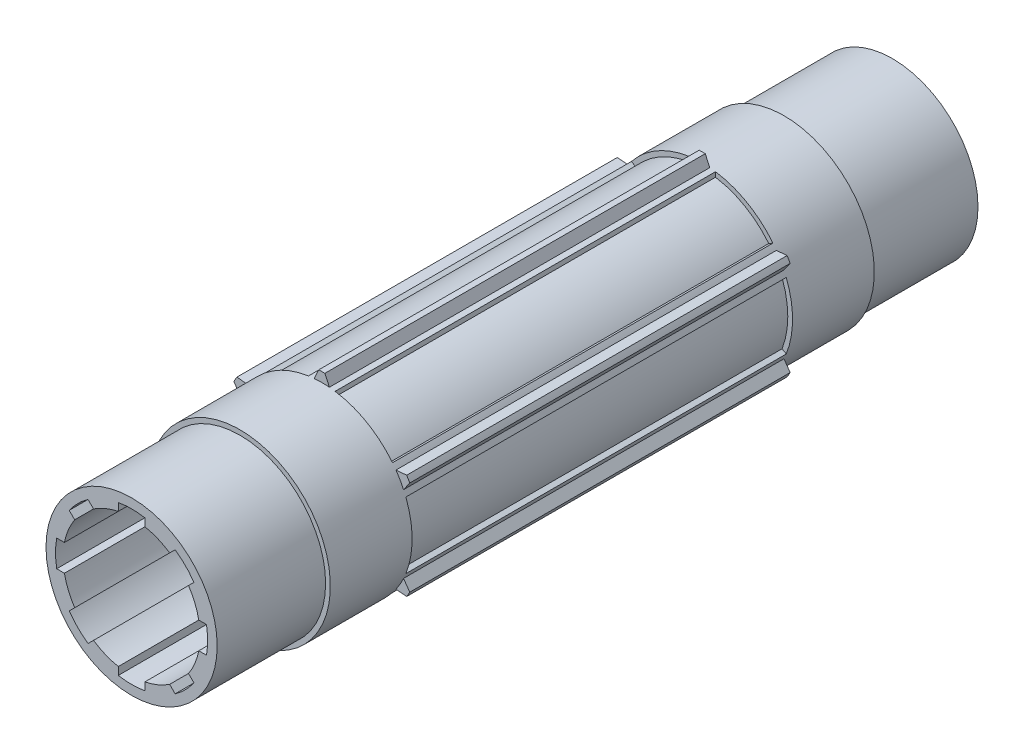
from build123d import *
from build123d.topology import SkipClean

# Parameters (mm, degrees)
SKETCH1_R           = 22.5
BOSS_EXTRUDE1_DEPTH = 200
BOSS_EXTRUDE2_START = 50
BOSS_EXTRUDE2_DEPTH = 100
BOSS_EXTRUDE3_START = -50
SKETCH4_R           = 23.75
SKETCH4_R_2         = 22.5
BOSS_EXTRUDE3_DEPTH = 21.5
BOSS_EXTRUDE4_START = -171.5
SKETCH4_2_R         = 23.75
SKETCH4_2_R_2       = 22.5
BOSS_EXTRUDE4_DEPTH = 21.5


with BuildPart() as part:
    # Sketch1 → Boss-Extrude1 (new body)
    with BuildSketch(Plane.XY):
        Circle(SKETCH1_R)
        with BuildLine():
            Line((-3.5, 19.691368668), (-3.5, 17.656443583))
            ThreePointArc((-3.5, 17.656443583), (-6.888301783, 16.629831585), (-10.010117255, 14.959864723))
            Line((-10.010117255, 14.959864723), (-11.449026581, 16.39877405))
            ThreePointArc((-11.449026581, 16.39877405), (-14.142135624, 14.142135624), (-16.39877405, 11.449026581))
            Line((-16.39877405, 11.449026581), (-14.959864723, 10.010117255))
            ThreePointArc((-14.959864723, 10.010117255), (-16.629831585, 6.888301783), (-17.656443583, 3.5))
            Line((-17.656443583, 3.5), (-19.691368668, 3.5))
            ThreePointArc((-19.691368668, 3.5), (-20, 0), (-19.691368668, -3.5))
            Line((-19.691368668, -3.5), (-17.656443583, -3.5))
            ThreePointArc((-17.656443583, -3.5), (-16.629831585, -6.888301783), (-14.959864723, -10.010117255))
            Line((-14.959864723, -10.010117255), (-16.39877405, -11.449026581))
            ThreePointArc((-16.39877405, -11.449026581), (-14.142135624, -14.142135624), (-11.449026581, -16.39877405))
            Line((-11.449026581, -16.39877405), (-10.010117255, -14.959864723))
            ThreePointArc((-10.010117255, -14.959864723), (-6.888301783, -16.629831585), (-3.5, -17.656443583))
            Line((-3.5, -17.656443583), (-3.5, -19.691368668))
            ThreePointArc((-3.5, -19.691368668), (0, -20), (3.5, -19.691368668))
            Line((3.5, -19.691368668), (3.5, -17.656443583))
            ThreePointArc((3.5, -17.656443583), (6.888301783, -16.629831585), (10.010117255, -14.959864723))
            Line((10.010117255, -14.959864723), (11.449026581, -16.39877405))
            ThreePointArc((11.449026581, -16.39877405), (14.142135624, -14.142135624), (16.39877405, -11.449026581))
            Line((16.39877405, -11.449026581), (14.959864723, -10.010117255))
            ThreePointArc((14.959864723, -10.010117255), (16.629831585, -6.888301783), (17.656443583, -3.5))
            Line((17.656443583, -3.5), (19.691368668, -3.5))
            ThreePointArc((19.691368668, -3.5), (20, 0), (19.691368668, 3.5))
            Line((19.691368668, 3.5), (17.656443583, 3.5))
            ThreePointArc((17.656443583, 3.5), (16.629831585, 6.888301783), (14.959864723, 10.010117255))
            Line((14.959864723, 10.010117255), (16.39877405, 11.449026581))
            ThreePointArc((16.39877405, 11.449026581), (14.142135624, 14.142135624), (11.449026581, 16.39877405))
            Line((11.449026581, 16.39877405), (10.010117255, 14.959864723))
            ThreePointArc((10.010117255, 14.959864723), (6.888301783, 16.629831585), (3.5, 17.656443583))
            Line((3.5, 17.656443583), (3.5, 19.691368668))
            ThreePointArc((3.5, 19.691368668), (0, 20), (-3.5, 19.691368668))
        make_face(mode=Mode.SUBTRACT)
    extrude(amount=BOSS_EXTRUDE1_DEPTH)

    # Sketch3 → Boss-Extrude2 (add)
    with BuildSketch(Plane.XY.offset(BOSS_EXTRUDE2_START)):
        with BuildLine():
            Line((-2, 23.665639649), (-0.800587161, 26.237788783))
            ThreePointArc((-0.800587161, 26.237788783), (0, 26.25), (0.800587161, 26.237788783))
            Line((0.800587161, 26.237788783), (2, 23.665639649))
            ThreePointArc((2, 23.665639649), (2.751390898, 23.590090041), (3.5, 23.490689645))
            Line((3.5, 23.490689645), (3.5, 22.226110771))
            ThreePointArc((3.5, 22.226110771), (0, 22.5), (-3.5, 22.226110771))
            Line((-3.5, 22.226110771), (-3.5, 23.490689645))
            ThreePointArc((-3.5, 23.490689645), (-2.751390898, 23.590090041), (-2, 23.665639649))
        make_face()
        with BuildLine():
            Line((17.498376555, 14.144144299), (18.593533985, 14.776433736))
            ThreePointArc((18.593533985, 14.776433736), (19.053921804, 14.177819434), (19.495045133, 13.564870632))
            Line((19.495045133, 13.564870632), (22.322298044, 13.812223211))
            ThreePointArc((22.322298044, 13.812223211), (22.733166849, 13.125), (23.122885205, 12.425565572))
            Line((23.122885205, 12.425565572), (21.495045133, 10.100769017))
            ThreePointArc((21.495045133, 10.100769017), (21.805312702, 9.412270607), (22.093533985, 8.714255909))
            Line((22.093533985, 8.714255909), (20.998376555, 8.081966472))
            ThreePointArc((20.998376555, 8.081966472), (19.485571585, 11.25), (17.498376555, 14.144144299))
        make_face()
        with BuildLine():
            Line((20.998376555, -8.081966472), (22.093533985, -8.714255909))
            ThreePointArc((22.093533985, -8.714255909), (21.805312702, -9.412270607), (21.495045133, -10.100769017))
            Line((21.495045133, -10.100769017), (23.122885205, -12.425565572))
            ThreePointArc((23.122885205, -12.425565572), (22.733166849, -13.125), (22.322298044, -13.812223211))
            Line((22.322298044, -13.812223211), (19.495045133, -13.564870632))
            ThreePointArc((19.495045133, -13.564870632), (19.053921804, -14.177819434), (18.593533985, -14.776433736))
            Line((18.593533985, -14.776433736), (17.498376555, -14.144144299))
            ThreePointArc((17.498376555, -14.144144299), (19.485571585, -11.25), (20.998376555, -8.081966472))
        make_face()
        with BuildLine():
            Line((3.5, -22.226110771), (3.5, -23.490689645))
            ThreePointArc((3.5, -23.490689645), (2.751390898, -23.590090041), (2, -23.665639649))
            Line((2, -23.665639649), (0.800587161, -26.237788783))
            ThreePointArc((0.800587161, -26.237788783), (0, -26.25), (-0.800587161, -26.237788783))
            Line((-0.800587161, -26.237788783), (-2, -23.665639649))
            ThreePointArc((-2, -23.665639649), (-2.751390898, -23.590090041), (-3.5, -23.490689645))
            Line((-3.5, -23.490689645), (-3.5, -22.226110771))
            ThreePointArc((-3.5, -22.226110771), (0, -22.5), (3.5, -22.226110771))
        make_face()
        with BuildLine():
            Line((-17.498376555, -14.144144299), (-18.593533985, -14.776433736))
            ThreePointArc((-18.593533985, -14.776433736), (-19.053921804, -14.177819434), (-19.495045133, -13.564870632))
            Line((-19.495045133, -13.564870632), (-22.322298044, -13.812223211))
            ThreePointArc((-22.322298044, -13.812223211), (-22.733166849, -13.125), (-23.122885205, -12.425565572))
            Line((-23.122885205, -12.425565572), (-21.495045133, -10.100769017))
            ThreePointArc((-21.495045133, -10.100769017), (-21.805312702, -9.412270607), (-22.093533985, -8.714255909))
            Line((-22.093533985, -8.714255909), (-20.998376555, -8.081966472))
            ThreePointArc((-20.998376555, -8.081966472), (-19.485571585, -11.25), (-17.498376555, -14.144144299))
        make_face()
        with BuildLine():
            Line((-20.998376555, 8.081966472), (-22.093533985, 8.714255909))
            ThreePointArc((-22.093533985, 8.714255909), (-21.805312702, 9.412270607), (-21.495045133, 10.100769017))
            Line((-21.495045133, 10.100769017), (-23.122885205, 12.425565572))
            ThreePointArc((-23.122885205, 12.425565572), (-22.733166849, 13.125), (-22.322298044, 13.812223211))
            Line((-22.322298044, 13.812223211), (-19.495045133, 13.564870632))
            ThreePointArc((-19.495045133, 13.564870632), (-19.053921804, 14.177819434), (-18.593533985, 14.776433736))
            Line((-18.593533985, 14.776433736), (-17.498376555, 14.144144299))
            ThreePointArc((-17.498376555, 14.144144299), (-19.485571585, 11.25), (-20.998376555, 8.081966472))
        make_face()
    extrude(amount=BOSS_EXTRUDE2_DEPTH)

    # Sketch4 → Boss-Extrude3 (add)
    with SkipClean():  # the faces are left unmerged after this step: merging them gives an invalid solid
        with BuildSketch(Plane.XY.offset(200).offset(BOSS_EXTRUDE3_START)):
            with Locations(Location((0, 0, 0), (0, 0, 180))):
                Circle(SKETCH4_R)
            with Locations(Location((0, 0, 0), (0, 0, 180))):
                Circle(SKETCH4_R_2, mode=Mode.SUBTRACT)
        extrude(amount=BOSS_EXTRUDE3_DEPTH)

    # Sketch4<2> → Boss-Extrude4 (add)
    with SkipClean():  # the faces are left unmerged after this step: merging them gives an invalid solid
        with BuildSketch(Plane.XY.offset(200).offset(BOSS_EXTRUDE4_START)):
            with Locations(Location((0, 0, 0), (0, 0, 180))):
                Circle(SKETCH4_2_R)
            with Locations(Location((0, 0, 0), (0, 0, 180))):
                Circle(SKETCH4_2_R_2, mode=Mode.SUBTRACT)
        extrude(amount=BOSS_EXTRUDE4_DEPTH)


solid = part.part
